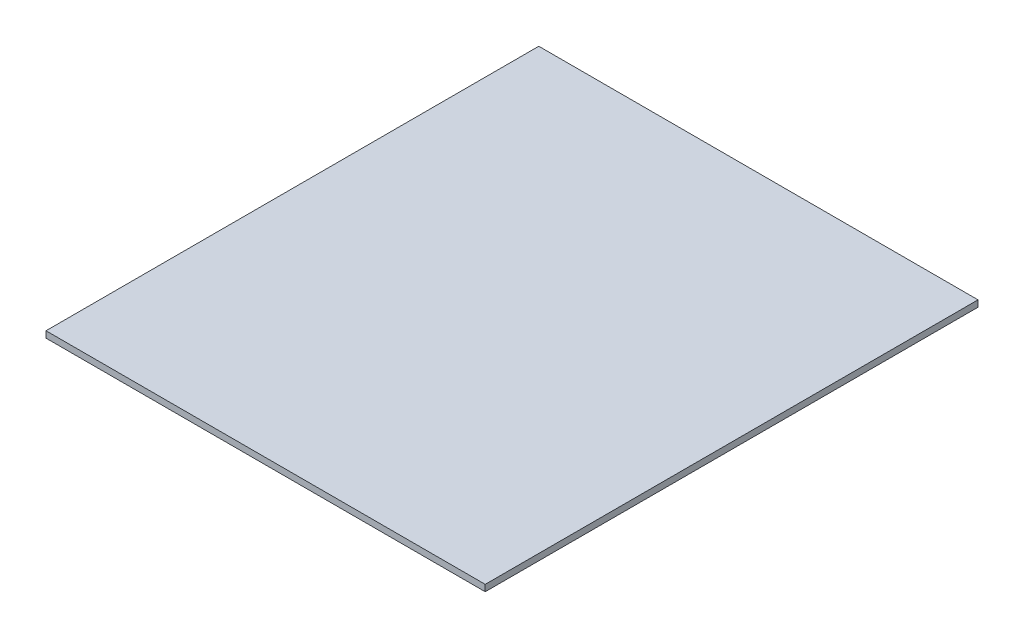
from build123d import *

# Parameters (mm, degrees)
SKETCH1_W           = 410
SKETCH1_H           = 460
BOSS_EXTRUDE1_DEPTH = 6


with BuildPart() as part:
    # Sketch1 → Boss-Extrude1 (new body)
    with BuildSketch(Plane(origin=(0, 0, 0), x_dir=(1, 0, 0), z_dir=(0, 1, 0))):
        Rectangle(SKETCH1_W, SKETCH1_H)
    extrude(amount=BOSS_EXTRUDE1_DEPTH)


solid = part.part
